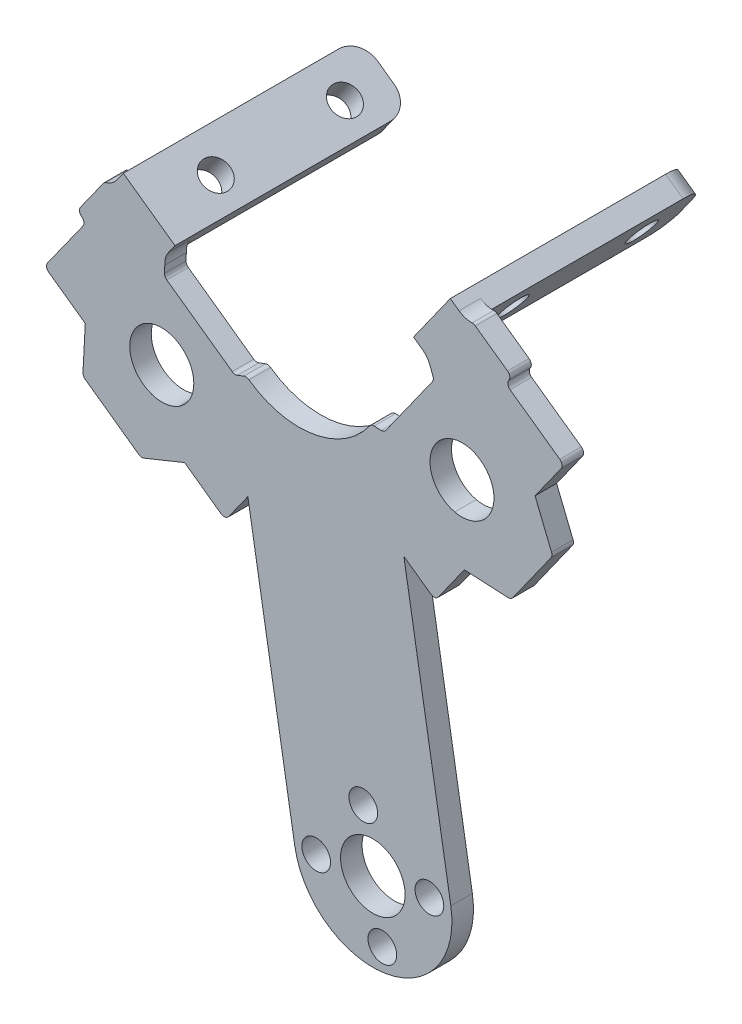
from build123d import *

# Parameters (mm, degrees)
SKETCH_2_R          = 73.899050909
EXTRUDE_2_DEPTH     = 3
SKETCH_6_OUTSIDE_W  = 191.606
SKETCH_6_OUTSIDE_H  = 191.606
CUT_EXTRUDE_4_DEPTH = 10
SKETCH_7_R          = 4.5
SKETCH_7_R_2        = 2
CUT_EXTRUDE_5_DEPTH = 10
SKETCH_8_R          = 4.5
CUT_EXTRUDE_6_DEPTH = 10
SKETCH_9_W          = 6.25
SKETCH_9_H          = 33
SKETCH_9_R          = 2
EXTRUDE_3_DEPTH     = 20
SKETCH_10_W         = 6.25
SKETCH_10_H         = 30
CUT_EXTRUDE_7_DEPTH = 17
SKETCH_11_W         = 1.5
SKETCH_11_H         = 33
SKETCH_11_W_2       = 1.098612182
EXTRUDE_4_DEPTH     = 2.999995
FILLET_1_R          = 3


with BuildPart() as part:
    # 草图2 → 凸台-拉伸2 (new body)
    with BuildSketch(Plane.XY):
        Circle(SKETCH_2_R)
    extrude(amount=EXTRUDE_2_DEPTH)

    # 草图6 outside → 切除-拉伸4 (cut)
    with BuildSketch(Plane.XY.offset(3)):
        Rectangle(SKETCH_6_OUTSIDE_W, SKETCH_6_OUTSIDE_H)
        with BuildLine():
            Line((-31.535008434, 35.392907634), (-24.330725879, 30.255179498))
            ThreePointArc((-24.330725879, 30.255179498), (-24.094123176, 29.977447186), (-24.016566775, 29.6209348))
            Line((-24.016566775, 29.6209348), (-24.048055472, 28.621430692))
            ThreePointArc((-24.048055472, 28.621430692), (-23.970499071, 28.264918306), (-23.733896368, 27.987185994))
            Line((-23.733896368, 27.987185994), (-14.617442117, 21.485794197))
            ThreePointArc((-14.617442117, 21.485794197), (-14.277785331, 21.352567532), (-13.915454513, 21.395374713))
            Line((-13.915454513, 21.395374713), (-12.980724299, 21.750732881))
            ThreePointArc((-12.980724299, 21.750732881), (-12.618393481, 21.793540061), (-12.278736695, 21.660313397))
            ThreePointArc((-12.278736695, 21.660313397), (-3.294948021, 19.590594088), (4.517495731, 24.485276874))
            ThreePointArc((4.517495731, 24.485276874), (4.794882728, 24.722284322), (5.15128164, 24.800360515))
            Line((5.15128164, 24.800360515), (6.150830603, 24.770329354))
            ThreePointArc((6.150830603, 24.770329354), (6.507229515, 24.848405547), (6.784616512, 25.085412994))
            Line((6.784616512, 25.085412994), (13.272707556, 34.211338045))
            ThreePointArc((13.272707556, 34.211338045), (13.405438783, 34.551188744), (13.362103288, 34.913456755))
            Line((13.362103288, 34.913456755), (13.005382451, 35.847667782))
            ThreePointArc((13.005382451, 35.847667782), (12.962046956, 36.209935793), (13.094778183, 36.549786492))
            Line((13.094778183, 36.549786492), (18.221995392, 43.761553351))
            ThreePointArc((18.221995392, 43.761553351), (18.708323153, 44.066496264), (19.267836012, 43.938237808))
            Line((19.267836012, 43.938237808), (23.750427961, 40.751331876))
            ThreePointArc((23.750427961, 40.751331876), (24.055370874, 40.265004115), (23.927112418, 39.705491256))
            ThreePointArc((23.927112418, 39.705491256), (23.798853962, 39.145978396), (24.103796875, 38.659650636))
            Line((24.103796875, 38.659650636), (31.031438978, 33.734432377))
            ThreePointArc((31.031438978, 33.734432377), (31.336381891, 33.248104616), (31.208123435, 32.688591757))
            Line((31.208123435, 32.688591757), (27.586639421, 27.59473727))
            Line((27.586639421, 27.59473727), (29.886186599, 21.936685188))
            ThreePointArc((29.886186599, 21.936685188), (29.936337177, 21.567492307), (29.80264047, 21.219722765))
            Line((29.80264047, 21.219722765), (24.485385754, 13.740655704))
            ThreePointArc((24.485385754, 13.740655704), (24.200836556, 13.500134983), (23.835658301, 13.426220802))
            Line((23.835658301, 13.426220802), (17.736202905, 13.739453063))
            Line((17.736202905, 13.739453063), (14.114718892, 8.645598576))
            ThreePointArc((14.114718892, 8.645598576), (13.628391131, 8.340655663), (13.068878271, 8.468914119))
            Line((13.068878271, 8.468914119), (9.306333892, 11.143901076))
            Line((9.306333892, 11.143901076), (15.851133659, -27.769160612))
            ThreePointArc((15.851133659, -27.769160612), (6.806822505, -40.470956104), (-5.894972987, -31.42664495))
            Line((-5.894972987, -31.42664495), (-12.439772753, 7.486416738))
            Line((-12.439772753, 7.486416738), (-15.120243503, 3.727777092))
            ThreePointArc((-15.120243503, 3.727777092), (-15.607015422, 3.423543678), (-16.166340657, 3.552617894))
            Line((-16.166340657, 3.552617894), (-21.25490879, 7.181526042))
            Line((-21.25490879, 7.181526042), (-26.916308113, 4.890232022))
            ThreePointArc((-26.916308113, 4.890232022), (-27.285573732, 4.840619864), (-27.633147944, 4.974823555))
            Line((-27.633147944, 4.974823555), (-35.1044533, 10.30297878))
            ThreePointArc((-35.1044533, 10.30297878), (-35.344558829, 10.587878409), (-35.41794042, 10.953164059))
            Line((-35.41794042, 10.953164059), (-35.095814113, 17.052156207))
            Line((-35.095814113, 17.052156207), (-40.184382246, 20.681064356))
            ThreePointArc((-40.184382246, 20.681064356), (-40.48861566, 21.167836275), (-40.359541444, 21.727161509))
            Line((-40.359541444, 21.727161509), (-35.424226362, 28.647614171))
            ThreePointArc((-35.424226362, 28.647614171), (-35.295152147, 29.206939406), (-35.59938556, 29.693711325))
            ThreePointArc((-35.59938556, 29.693711325), (-35.903618974, 30.180483244), (-35.774544759, 30.739808479))
            Line((-35.774544759, 30.739808479), (-32.581105588, 35.217748436))
            ThreePointArc((-32.581105588, 35.217748436), (-32.094333668, 35.521981849), (-31.535008434, 35.392907634))
        make_face(mode=Mode.SUBTRACT)
    extrude(amount=-CUT_EXTRUDE_4_DEPTH, mode=Mode.SUBTRACT)

    # 草图7 → 切除-拉伸5 (cut)
    with BuildSketch(Plane.XY.offset(3)):
        with Locations((4.978080336, -29.597902781)):
            Circle(SKETCH_7_R)
        with Locations((3.651194467, -21.708709293)):
            Circle(SKETCH_7_R_2)
        with Locations((12.867273824, -28.271016911)):
            Circle(SKETCH_7_R_2)
        with Locations((6.304966206, -37.487096269)):
            Circle(SKETCH_7_R_2)
        with Locations((-2.911113152, -30.924788651)):
            Circle(SKETCH_7_R_2)
    extrude(amount=-CUT_EXTRUDE_5_DEPTH, mode=Mode.SUBTRACT)

    # 草图8 → 切除-拉伸6 (cut)
    with BuildSketch(Plane.XY.offset(3)):
        with Locations((-24.401296977, 17.408951983)):
            Circle(SKETCH_8_R)
        with Locations((17.442589177, 24.41531991)):
            Circle(SKETCH_8_R)
    extrude(amount=-CUT_EXTRUDE_6_DEPTH, mode=Mode.SUBTRACT)

    # 镜向3: part across plane


with BuildPart() as part_1:
    add(part.part)
    add(part.part.mirror(Plane(origin=(0, 0, 0), x_dir=(0, 0, 1), z_dir=(-0.9861491859840638, -0.16586073369839163, 0))))

    # 草图9 → 凸台-拉伸3 (add)
    with BuildSketch(Plane(origin=(-3.770666854, -5.287346609, 0), x_dir=(0.814170901346189, -0.5806253037899178, 0), z_dir=(-0.5806253037899178, -0.814170901346189, 0))):
        with Locations((-41.599903988, -13.5)):
            Rectangle(SKETCH_9_W, SKETCH_9_H)
        with Locations(Location((-41.452827346, -24, 0), (0, 0, 180))):
            Circle(SKETCH_9_R, mode=Mode.SUBTRACT)
        with Locations(Location((-41.452827346, -6, 0), (0, 0, 180))):
            Circle(SKETCH_9_R, mode=Mode.SUBTRACT)
    extrude(amount=-EXTRUDE_3_DEPTH)

    # 草图10 → 切除-拉伸7 (cut)
    with BuildSketch(Plane(origin=(-3.770666854, -5.287346609, 0), x_dir=(0.8141709013461893, -0.5806253037899172, 0), z_dir=(-0.5806253037899172, -0.8141709013461893, 0))):
        with Locations((-41.599903988, -15)):
            Rectangle(SKETCH_10_W, SKETCH_10_H)
    extrude(amount=-CUT_EXTRUDE_7_DEPTH, mode=Mode.SUBTRACT)

    # 草图11 → 凸台-拉伸4 (add)
    with BuildSketch(Plane(origin=(6.09996331, 8.553558714, 0), x_dir=(0.8141709013461892, -0.5806253037899176, 0), z_dir=(0.5806253037899175, 0.8141709013461891, 0))):
        with Locations((-45.474903988, 13.5)):
            Rectangle(SKETCH_11_W, SKETCH_11_H)
        with Locations((-37.925597897, 13.5)):
            Rectangle(SKETCH_11_W_2, SKETCH_11_H)
    extrude(amount=EXTRUDE_4_DEPTH)

    # 圆角1
    fillet_1_edges = [part_1.edges().sort_by_distance(p)[0] for p in [
        (-31.535008434, 35.392907634, 1.5),
        (-24.330725879, 30.255179498, 1.5),
        (-23.459789375, 31.476433815, -30),
        (-30.66407193, 36.614161951, -30),
    ]]
    fillet(fillet_1_edges, radius=FILLET_1_R)

    # 镜向4: part across plane


with BuildPart() as part_2:
    add(part_1.part)
    add(part_1.part.mirror(Plane(origin=(0, 0, 0), x_dir=(0, 0, 1), z_dir=(-0.9861491859840638, -0.16586073369839163, 0))))


solid = part_2.part
